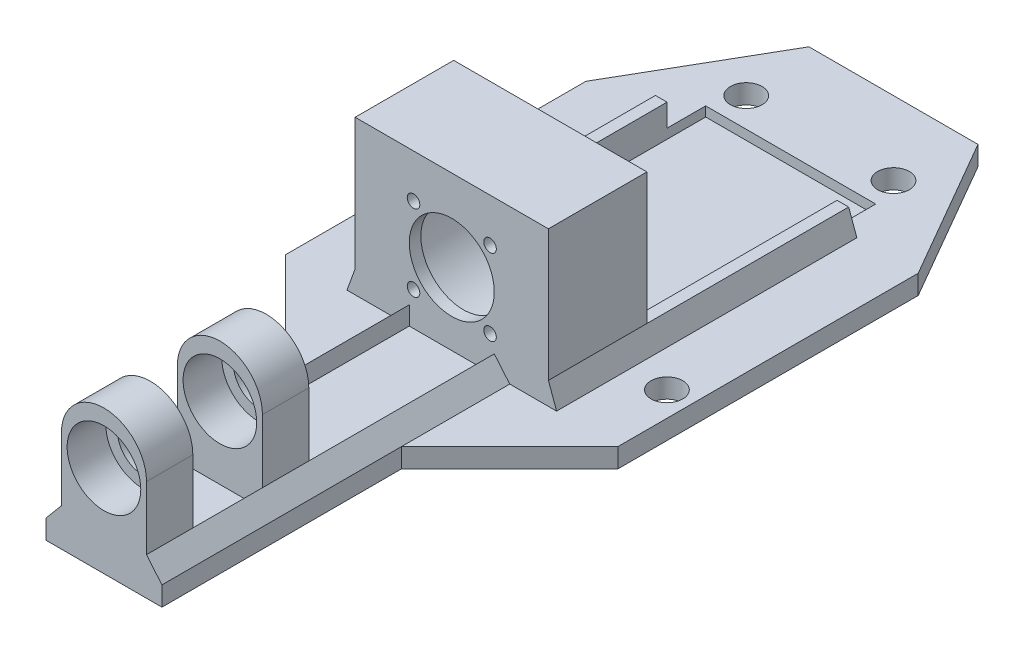
from build123d import *

# Parameters (mm, degrees)
ESQUISSE1_W                  = 50
ESQUISSE1_H                  = 42.3
BOSS_EXTRU_1_DEPTH           = 25.5
ESQUISSE4_R                  = 18.1
ENL_V_MAT_EXTRU_3_DEPTH      = 22.5
ENL_V_MAT_EXTRU_4_DEPTH      = 62.713369702
ENL_V_MAT_EXTRU_4_DEPTH_BACK = 62.713369702
ESQUISSE5_R                  = 11
ESQUISSE6_R                  = 1.625
ENL_V_MAT_EXTRU_5_DEPTH      = 10
BOSS_EXTRU_2_DEPTH           = 77.7
ESQUISSE16_W                 = 3
ESQUISSE16_H                 = 8.332527472
BOSS_EXTRU_4_DEPTH           = 52.2
ESQUISSE17_W                 = 86
ESQUISSE17_H                 = 2.5
BOSS_EXTRU_5_DEPTH           = 77.7
BOSS_EXTRU_7_DEPTH           = 5
BOSS_EXTRU_8_DEPTH           = 12
ESQUISSE22_R                 = 9.525
ENL_V_MAT_EXTRU_6_DEPTH      = 10
R_P_TITION_LIN_AIRE2_COUNT   = 2
R_P_TITION_LIN_AIRE2_PITCH   = 30
ESQUISSE23_R                 = 6.5
ENL_V_MAT_EXTRU_7_DEPTH      = 177.868821447
BOSS_EXTRU_9_DEPTH           = 5
ESQUISSE27_W                 = 44
ESQUISSE27_H                 = 2.5
ENL_V_MAT_EXTRU_9_DEPTH      = 10
ESQUISSE24_R                 = 4.1
ENL_V_MAT_EXTRU_8_DEPTH      = 140.81519946
BOSS_EXTRU_10_DEPTH          = 90


with BuildPart() as part:
    # Esquisse1 → Boss.-Extru.1 (new body)
    with BuildSketch(Plane.XY):
        with Locations((25, 21.15)):
            Rectangle(ESQUISSE1_W, ESQUISSE1_H)
    extrude(amount=BOSS_EXTRU_1_DEPTH)

    # Esquisse4 → Enlèv. mat.-Extru.3 (cut)
    with BuildSketch(Plane.XY):
        with Locations(Location((25, 21.15, 0), (0, 0, 180))):
            Circle(ESQUISSE4_R)
    extrude(amount=ENL_V_MAT_EXTRU_3_DEPTH, mode=Mode.SUBTRACT)

    # Esquisse5 → Enlèv. mat.-Extru.4 (cut, two sides: drawn at the far end of the back side and taken through both)
    with BuildSketch(Plane(origin=(37, 0, 25.5), x_dir=(-1, 0, 0), z_dir=(0, 0, -1)).offset(-ENL_V_MAT_EXTRU_4_DEPTH_BACK)):
        with Locations((12, 21.15)):
            Circle(ESQUISSE5_R)
    extrude(amount=ENL_V_MAT_EXTRU_4_DEPTH + ENL_V_MAT_EXTRU_4_DEPTH_BACK, mode=Mode.SUBTRACT)

    # Esquisse6 → Enlèv. mat.-Extru.5 (cut)
    with BuildSketch(Plane(origin=(0, 0, 25.5), x_dir=(-1, 0, 0), z_dir=(0, 0, -1))):
        with Locations((-34.899494937, 31.049494937)):
            Circle(ESQUISSE6_R)
        with Locations((-15.100505063, 31.049494937)):
            Circle(ESQUISSE6_R)
        with Locations((-15.100505063, 11.250505063)):
            Circle(ESQUISSE6_R)
        with Locations((-34.899494937, 11.250505063)):
            Circle(ESQUISSE6_R)
    extrude(amount=ENL_V_MAT_EXTRU_5_DEPTH, mode=Mode.SUBTRACT)

    # Esquisse7 → Boss.-Extru.2 (add)
    with BuildSketch(Plane.XY.offset(25.5)):
        Polygon((50, 0), (68, 0), (68, 2.5), (52.12286639, 2.5), (50, 8.332527472), align=None)
        Polygon((-18, 0), (-18, 2.5), (-2.12286639, 2.5), (0, 8.332527472), (0, 0), align=None)
    extrude(amount=-BOSS_EXTRU_2_DEPTH)

    # Esquisse16 → Boss.-Extru.4 (add)
    with BuildSketch(Plane(origin=(0, 0, 0), x_dir=(-1, 0, 0), z_dir=(0, 0, -1))):
        with Locations((-1.5, 4.166263736)):
            Rectangle(ESQUISSE16_W, ESQUISSE16_H)
        with Locations((-48.5, 4.166263736)):
            Rectangle(ESQUISSE16_W, ESQUISSE16_H)
    extrude(amount=BOSS_EXTRU_4_DEPTH)

    # Esquisse17 → Boss.-Extru.5 (add)
    with BuildSketch(Plane.XY.offset(25.5)):
        with Locations((25, -1.25)):
            Rectangle(ESQUISSE17_W, ESQUISSE17_H)
    extrude(amount=-BOSS_EXTRU_5_DEPTH)

    # Esquisse20 → Boss.-Extru.7 (add)
    with BuildSketch(Plane.XZ.offset(2.5)):
        Polygon((-18, 25.5), (10, 53.5), (10, 115.5), (40, 115.5), (40, 53.5), (68, 25.5), align=None)
    extrude(amount=-BOSS_EXTRU_7_DEPTH)

    # Esquisse21 → Boss.-Extru.8 (add)
    with BuildSketch(Plane.XY.offset(115.5)):
        with BuildLine():
            Line((10, 2.5), (14, 7.26701437))
            Line((14, 7.26701437), (14, 23.65))
            ThreePointArc((14, 23.65), (25, 34.65), (36, 23.65))
            Line((36, 23.65), (36, 7.26701437))
            Line((36, 7.26701437), (40, 2.5))
            Line((40, 2.5), (10, 2.5))
        make_face()
    boss_extru_8 = extrude(amount=-BOSS_EXTRU_8_DEPTH)

    # Esquisse22 → Enlèv. mat.-Extru.6 (cut)
    with BuildSketch(Plane.XY.offset(115.5)):
        with Locations((25, 21.15)):
            Circle(ESQUISSE22_R)
    enl_v_mat_extru_6 = extrude(amount=-ENL_V_MAT_EXTRU_6_DEPTH, mode=Mode.SUBTRACT)

    # Répétition linéaire2: Boss.-Extru.8, Enlèv. mat.-Extru.6 ×2
    with Locations(*[(0, 0, -i * R_P_TITION_LIN_AIRE2_PITCH) for i in range(1, R_P_TITION_LIN_AIRE2_COUNT)]):
        add(boss_extru_8)
        add(enl_v_mat_extru_6, mode=Mode.SUBTRACT)

    # Esquisse23 → Enlèv. mat.-Extru.7 (cut, through all)
    with BuildSketch(Plane.XY.offset(105.5)):
        with Locations((25, 21.15)):
            Circle(ESQUISSE23_R)
    extrude(amount=-ENL_V_MAT_EXTRU_7_DEPTH, mode=Mode.SUBTRACT)

    # Esquisse26 → Boss.-Extru.9 (add)
    with BuildSketch(Plane.XZ.offset(2.5)):
        Polygon((-18, -52.2), (3.131019852, -88.8), (46.868980148, -88.8), (68, -52.2), align=None)
    extrude(amount=-BOSS_EXTRU_9_DEPTH)

    # Esquisse27 → Enlèv. mat.-Extru.9 (cut)
    with BuildSketch(Plane.XY.offset(-52.2)):
        with Locations((25, 1.25)):
            Rectangle(ESQUISSE27_W, ESQUISSE27_H)
    extrude(amount=-ENL_V_MAT_EXTRU_9_DEPTH, mode=Mode.SUBTRACT)

    # Esquisse24 → Enlèv. mat.-Extru.8 (cut, through all)
    with BuildSketch(Plane(origin=(0, 2.5, 0), x_dir=(1, 0, 0), z_dir=(0, 1, 0))):
        with Locations(Location((61.62286639, -6.45, 0), (0, 0, 180))):
            Circle(ESQUISSE24_R)
        with Locations(Location((-11.62286639, -6.45, 0), (0, 0, 180))):
            Circle(ESQUISSE24_R)
        with Locations(Location((5.95, 69.75, 0), (0, 0, 180))):
            Circle(ESQUISSE24_R)
        with Locations(Location((44.05, 69.75, 0), (0, 0, 180))):
            Circle(ESQUISSE24_R)
    extrude(amount=-ENL_V_MAT_EXTRU_8_DEPTH, mode=Mode.SUBTRACT)

    # Esquisse28 → Boss.-Extru.10 (add)
    with BuildSketch(Plane.XY.offset(115.5)):
        Polygon((14, 7.26701437), (14, 2.5), (10, 2.5), align=None)
        Polygon((36, 7.26701437), (36, 2.5), (40, 2.5), align=None)
    extrude(amount=-BOSS_EXTRU_10_DEPTH)


solid = part.part
